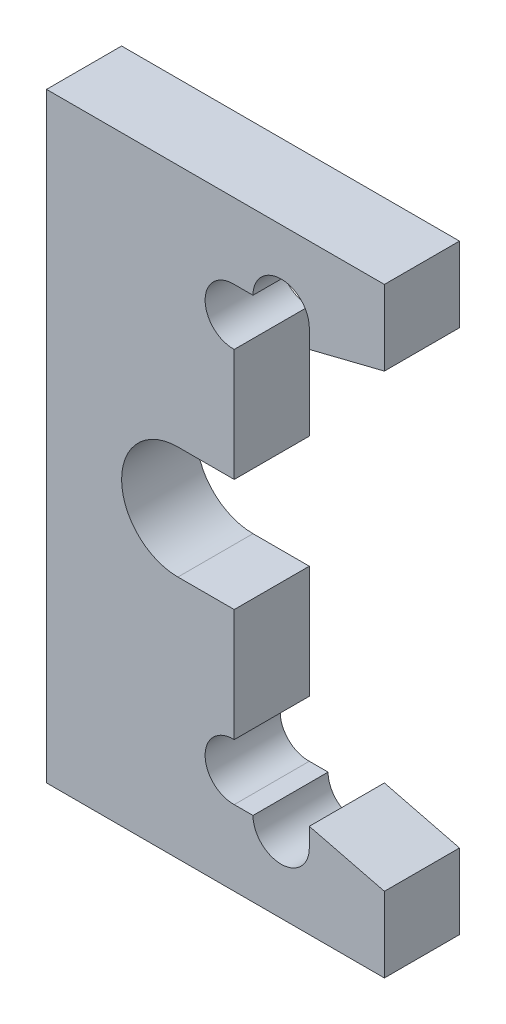
from build123d import *

# Parameters (mm, degrees)
BOSS_EXTRUDE1_DEPTH = 2


with BuildPart() as part:
    # Sketch1 → Boss-Extrude1 (new body)
    with BuildSketch(Plane.XY):
        with BuildLine():
            Line((13.368173221, 13.377065301), (4.368173221, 13.377065301))
            Line((4.368173221, 13.377065301), (4.368173221, 5.377065301))
            Line((4.368173221, 5.377065301), (6.368173221, 5.377065301))
            ThreePointArc((6.368173221, 5.377065301), (6.80751305, 6.437725473), (7.868173221, 6.877065301))
            Line((7.868173221, 6.877065301), (9.368173221, 6.877065301))
            Line((9.368173221, 6.877065301), (9.368173221, 9.877956548))
            ThreePointArc((9.368173221, 9.877956548), (8.59232295, 10.627510924), (9.368173221, 11.377065301))
            Line((9.368173221, 11.377065301), (9.868173221, 11.377065301))
            ThreePointArc((9.868173221, 11.377065301), (10.618173221, 12.127065301), (11.368173221, 11.377065301))
            Line((11.368173221, 11.377065301), (11.368173221, 10.877065301))
            Line((11.368173221, 10.877065301), (13.368173221, 11.377065301))
            Line((13.368173221, 11.377065301), (13.368173221, 13.377065301))
        make_face()
    boss_extrude1 = extrude(amount=BOSS_EXTRUDE1_DEPTH)

    # Mirror1: Boss-Extrude1 across plane
    add(boss_extrude1.mirror(Plane(origin=(6.368173221, 5.377065301, 2), x_dir=(0, 0, 1), z_dir=(0, 1, 0))))


solid = part.part
